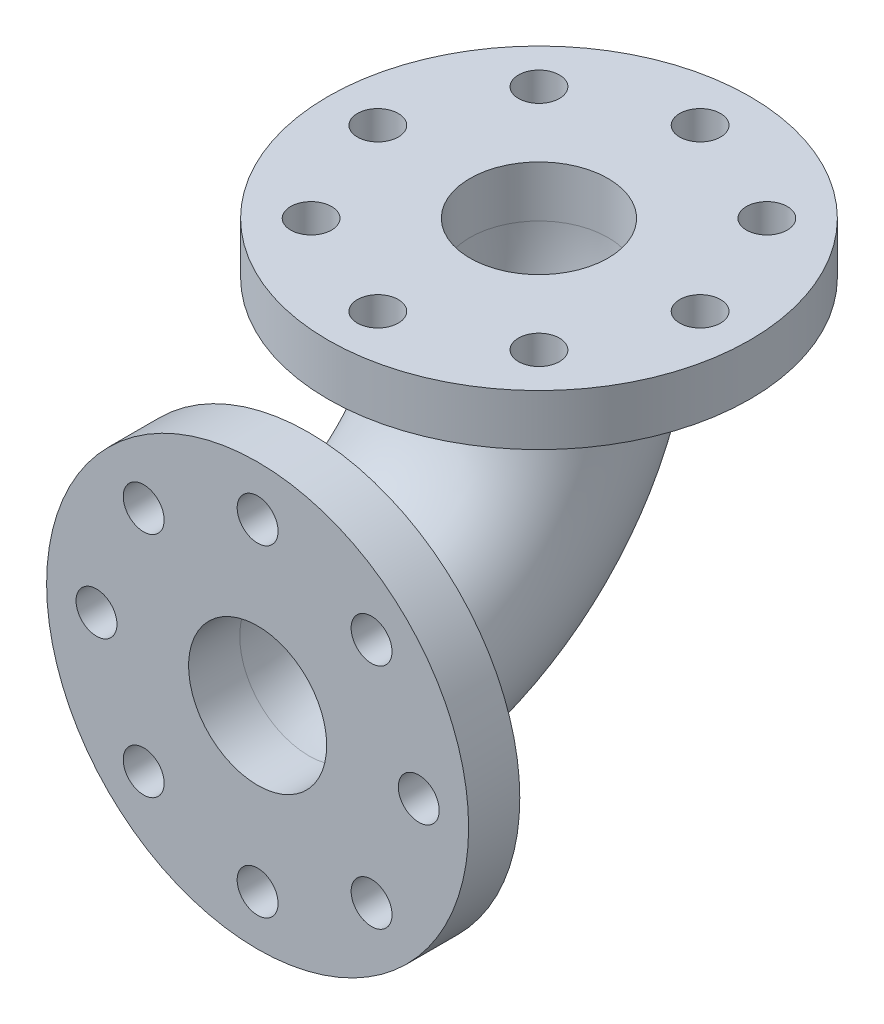
from build123d import *

# Parameters (mm, degrees)
IZIM2_R                     = 82.5
IZIM2_R_2                   = 27
Y_KSEKLIK_EKSTR_ZYON1_DEPTH = 20
IZIM3_R                     = 8
KES_EKSTR_ZYON1_DEPTH       = 20
IZIM4_R                     = 43
IZIM4_R_2                   = 27


with BuildPart() as part:
    # Çizim2 → Yükseklik-Ekstrüzyon1 (new body)
    with BuildSketch(Plane.XY):
        Circle(IZIM2_R)
        Circle(IZIM2_R_2, mode=Mode.SUBTRACT)
    y_kseklik_ekstr_zyon1 = extrude(amount=Y_KSEKLIK_EKSTR_ZYON1_DEPTH)

    # Çizim3 → Kes-Ekstrüzyon1 (cut)
    with BuildSketch(Plane.XY.offset(20)):
        with Locations((0, 63)):
            Circle(IZIM3_R)
        with Locations((44.547727215, 44.547727215)):
            Circle(IZIM3_R)
        with Locations((63, 0)):
            Circle(IZIM3_R)
        with Locations((44.547727215, -44.547727215)):
            Circle(IZIM3_R)
        with Locations((0, -63)):
            Circle(IZIM3_R)
        with Locations((-44.547727215, -44.547727215)):
            Circle(IZIM3_R)
        with Locations((-63, 0)):
            Circle(IZIM3_R)
        with Locations((-44.547727215, 44.547727215)):
            Circle(IZIM3_R)
    kes_ekstr_zyon1 = extrude(amount=-KES_EKSTR_ZYON1_DEPTH, mode=Mode.SUBTRACT)

    # Süpür1: sweep along a path in Çizim5
    with BuildLine(Plane(origin=(0, 0, 0), x_dir=(0, 0, -1), z_dir=(1, 0, 0))) as s_p_r1_path:
        ThreePointArc((0, 0), (63.639610307, 26.360389693), (90, 90))
    # Çizim4 → Süpür1 (sweep)
    with BuildSketch(Plane(origin=(0, 0, 0), x_dir=(-1, 0, 0), z_dir=(0, 0, -1))):
        Circle(IZIM4_R)
        Circle(IZIM4_R_2, mode=Mode.SUBTRACT)
    sweep(path=s_p_r1_path.line)

    # Aynalama3: Yükseklik-Ekstrüzyon1, Kes-Ekstrüzyon1 across plane
    add(y_kseklik_ekstr_zyon1.mirror(Plane(origin=(0, 45, -45), x_dir=(0, 0.7071067811865475, 0.7071067811865477), z_dir=(0, -0.7071067811865476, 0.7071067811865475))))
    add(kes_ekstr_zyon1.mirror(Plane(origin=(0, 45, -45), x_dir=(0, 0.7071067811865475, 0.7071067811865477), z_dir=(0, -0.7071067811865476, 0.7071067811865475))), mode=Mode.SUBTRACT)


solid = part.part
